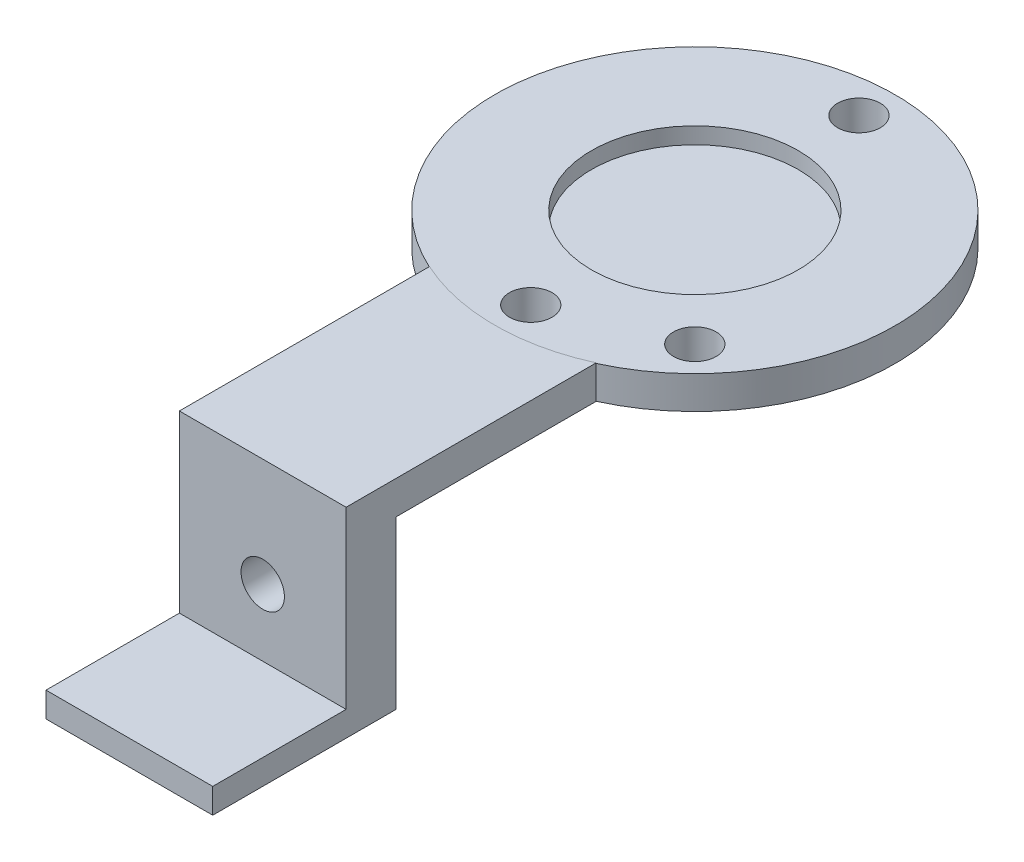
from build123d import *

# Parameters (mm, degrees)
SKETCH1_R           = 30.5
BOSS_EXTRUDE1_DEPTH = 5
SKETCH2_R           = 15.75
CUT_EXTRUDE1_DEPTH  = 2.5
SKETCH3_R           = 15.75
BOSS_EXTRUDE2_DEPTH = 2.5
SKETCH4_R           = 3.25
CUT_EXTRUDE2_DEPTH  = 5.08
SKETCH5_R           = 3.25
CUT_EXTRUDE3_DEPTH  = 5.08
SKETCH6_R           = 3.25
CUT_EXTRUDE4_DEPTH  = 5.08
BOSS_EXTRUDE3_DEPTH = 5.08
SKETCH8_W           = 25.4
SKETCH8_H           = 7.62
BOSS_EXTRUDE4_DEPTH = 25.4
SKETCH9_W           = 25.4
SKETCH9_H           = 3.81
BOSS_EXTRUDE5_DEPTH = 20.32
CUT_EXTRUDE5_DEPTH  = 7.62
SKETCH11_R          = 4.826
CUT_EXTRUDE6_DEPTH  = 2.54


with BuildPart() as part:
    # Sketch1 → Boss-Extrude1 (new body)
    with BuildSketch(Plane(origin=(0, 0, 0), x_dir=(1, 0, 0), z_dir=(0, 1, 0))):
        with Locations(Location((0, 0, 0), (0, 0, 270))):
            Circle(SKETCH1_R)
    extrude(amount=BOSS_EXTRUDE1_DEPTH)

    # Sketch2 → Cut-Extrude1 (cut)
    with BuildSketch(Plane(origin=(0, 5, 0), x_dir=(1, 0, 0), z_dir=(0, 1, 0))):
        with Locations(Location((0, 0, 0), (0, 0, 270))):
            Circle(SKETCH2_R)
    extrude(amount=-CUT_EXTRUDE1_DEPTH, mode=Mode.SUBTRACT)

    # Sketch3 → Boss-Extrude2 (add)
    with BuildSketch(Plane.XZ):
        with Locations(Location((0, 0, 0), (0, 0, 90))):
            Circle(SKETCH3_R)
    extrude(amount=BOSS_EXTRUDE2_DEPTH)

    # Sketch4 → Cut-Extrude2 (cut)
    with BuildSketch(Plane(origin=(0, 0, 0), x_dir=(-1, 0, 0), z_dir=(0, -1, 0))):
        with Locations(Location((0, 25, 0), (0, 0, 90))):
            Circle(SKETCH4_R)
    extrude(amount=-CUT_EXTRUDE2_DEPTH, mode=Mode.SUBTRACT)

    # Sketch5 → Cut-Extrude3 (cut)
    with BuildSketch(Plane.XZ):
        with Locations(Location((0, 25, 0), (0, 0, 270))):
            Circle(SKETCH5_R)
    extrude(amount=-CUT_EXTRUDE3_DEPTH, mode=Mode.SUBTRACT)

    # Sketch6 → Cut-Extrude4 (cut)
    with BuildSketch(Plane.XZ):
        with Locations(Location((17.674476483, 17.680862, 0), (0, 0, 270))):
            Circle(SKETCH6_R)
    extrude(amount=-CUT_EXTRUDE4_DEPTH, mode=Mode.SUBTRACT)

    # Sketch7 → Boss-Extrude3 (add)
    with BuildSketch(Plane(origin=(0, 0, 0), x_dir=(-1, 0, 0), z_dir=(0, -1, 0))):
        with BuildLine():
            ThreePointArc((12.7, -27.73012802), (6.499272859, -29.79948745), (0, -30.5))
            ThreePointArc((0, -30.5), (-6.499272859, -29.79948745), (-12.7, -27.73012802))
            Line((-12.7, -27.73012802), (-12.7, -65.83012802))
            Line((-12.7, -65.83012802), (12.7, -65.83012802))
            Line((12.7, -65.83012802), (12.7, -27.73012802))
        make_face()
    extrude(amount=-BOSS_EXTRUDE3_DEPTH)

    # Sketch8 → Boss-Extrude4 (add)
    with BuildSketch(Plane.XZ):
        with Locations((0, 62.02012802)):
            Rectangle(SKETCH8_W, SKETCH8_H)
    extrude(amount=BOSS_EXTRUDE4_DEPTH)

    # Sketch9 → Boss-Extrude5 (add)
    with BuildSketch(Plane.XY.offset(65.83012802)):
        with Locations((0, -23.495)):
            Rectangle(SKETCH9_W, SKETCH9_H)
    extrude(amount=BOSS_EXTRUDE5_DEPTH)

    # Sketch10 → Cut-Extrude5 (cut)
    with BuildSketch(Plane(origin=(0, 0, 58.21012802), x_dir=(-1, 0, 0), z_dir=(0, 0, -1))):
        with BuildLine():
            ThreePointArc((0, -8.128), (-3.302, -11.43), (0, -14.732))
            Line((0, -14.732), (0, -8.128))
        make_face()
        with BuildLine():
            Line((0, -8.128), (0, -14.732))
            ThreePointArc((0, -14.732), (2.334866591, -13.764866591), (3.302, -11.43))
            ThreePointArc((3.302, -11.43), (2.334866591, -9.095133409), (0, -8.128))
        make_face()
    extrude(amount=-CUT_EXTRUDE5_DEPTH, mode=Mode.SUBTRACT)

    # Sketch11 → Cut-Extrude6 (cut)
    with BuildSketch(Plane(origin=(0, 0, 58.21012802), x_dir=(-1, 0, 0), z_dir=(0, 0, -1))):
        with Locations((0, -11.43)):
            Circle(SKETCH11_R)
    extrude(amount=-CUT_EXTRUDE6_DEPTH, mode=Mode.SUBTRACT)


solid = part.part
